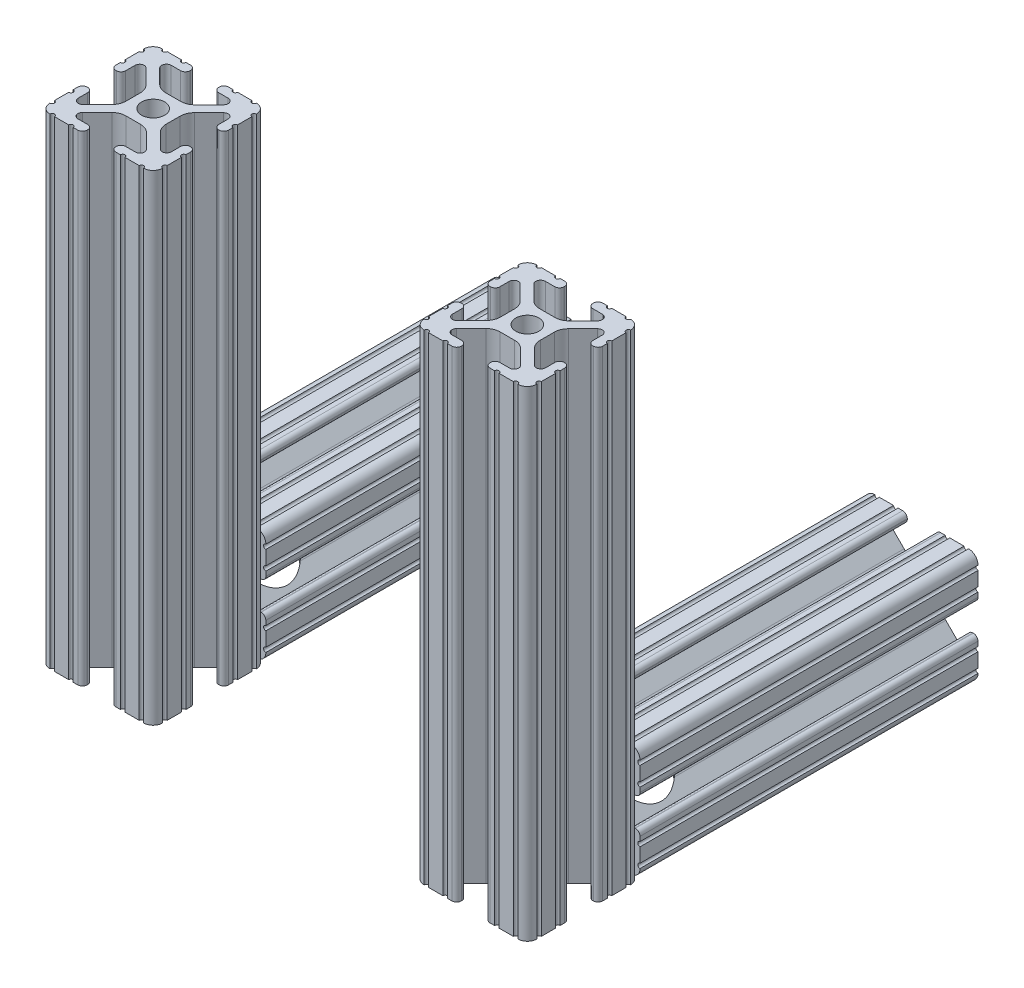
from build123d import *

# Parameters (mm, degrees)
SKETCH110_R                 = 2.6035
F_10_1010_PROFILE_1_DEPTH   = 108.324492
SKETCH110_ON_SEGMENT_2_R    = 2.6035
F_10_1010_PROFILE_1_2_DEPTH = 108.324492
SKETCH113_R                 = 2.6035
F_10_1010_PROFILE_3_DEPTH   = 76.2
SKETCH113_ON_SEGMENT_2_R    = 2.6035
F_10_1010_PROFILE_3_2_DEPTH = 76.2
SKETCH114_R                 = 7.065
CUT_EXTRUDE1_DEPTH          = 10.414
SKETCH115_R                 = 7.065
CUT_EXTRUDE2_DEPTH          = 10.414


with BuildPart() as part:
    # Sketch110 → 10 1010 PROFILE(1) (new body)
    with BuildSketch(Plane(origin=(-42.1775, 54.162246, 0), x_dir=(1, 0, 0), z_dir=(0, -1, 0))):
        with BuildLine():
            Line((-1.709253557, -4.4958), (1.709253557, -4.4958))
            ThreePointArc((1.709253557, -4.4958), (2.922935876, -4.736928798), (3.95226937, -5.423689619))
            Line((3.95226937, -5.423689619), (7.179652728, -8.645192207))
            ThreePointArc((7.179652728, -8.645192207), (7.414733441, -9.822812921), (6.41641086, -10.4902))
            Line((6.41641086, -10.4902), (4.28752, -10.4902))
            ThreePointArc((4.28752, -10.4902), (3.545750844, -10.797450844), (3.2385, -11.53922))
            Line((3.2385, -11.53922), (3.2385, -11.65098))
            ThreePointArc((3.2385, -11.65098), (3.545750844, -12.392749156), (4.28752, -12.7))
            Line((4.28752, -12.7), (5.3171344, -12.7))
            ThreePointArc((5.3171344, -12.7), (5.8251344, -12.192), (6.3331344, -12.7))
            Line((6.3331344, -12.7), (9.5504, -12.7))
            ThreePointArc((9.5504, -12.7), (10.058323491, -12.192000006), (10.566399977, -12.699846982))
            ThreePointArc((10.566399977, -12.699846982), (12.082522516, -12.082522516), (12.699846982, -10.566399977))
            ThreePointArc((12.699846982, -10.566399977), (12.192000006, -10.058323491), (12.7, -9.5504))
            Line((12.7, -9.5504), (12.7, -6.3330836))
            ThreePointArc((12.7, -6.3330836), (12.192, -5.8250836), (12.7, -5.3170836))
            Line((12.7, -5.3170836), (12.7, -4.287470133))
            ThreePointArc((12.7, -4.287470133), (12.392749156, -3.545700977), (11.65098, -3.238450133))
            Line((11.65098, -3.238450133), (11.53922, -3.238450133))
            ThreePointArc((11.53922, -3.238450133), (10.797450844, -3.545700977), (10.4902, -4.287470133))
            Line((10.4902, -4.287470133), (10.4902, -6.402089023))
            ThreePointArc((10.4902, -6.402089023), (9.856394933, -7.351113629), (8.736962546, -7.129240479))
            Line((8.736962546, -7.129240479), (5.440484187, -3.838768792))
            ThreePointArc((5.440484187, -3.838768792), (4.75073678, -2.808015636), (4.5085, -1.591658411))
            Line((4.5085, -1.591658411), (4.5085, 1.591658411))
            ThreePointArc((4.5085, 1.591658411), (4.75073678, 2.808015636), (5.440484187, 3.838768792))
            Line((5.440484187, 3.838768792), (8.736962546, 7.129240479))
            ThreePointArc((8.736962546, 7.129240479), (9.856394933, 7.351113629), (10.4902, 6.402089023))
            Line((10.4902, 6.402089023), (10.4902, 4.287470133))
            ThreePointArc((10.4902, 4.287470133), (10.797450844, 3.545700977), (11.53922, 3.238450133))
            Line((11.53922, 3.238450133), (11.65098, 3.238450133))
            ThreePointArc((11.65098, 3.238450133), (12.392749156, 3.545700977), (12.7, 4.287470133))
            Line((12.7, 4.287470133), (12.7, 5.3171344))
            ThreePointArc((12.7, 5.3171344), (12.192, 5.8251344), (12.7, 6.3331344))
            Line((12.7, 6.3331344), (12.7, 9.5504))
            ThreePointArc((12.7, 9.5504), (12.192000006, 10.058323491), (12.699846982, 10.566399977))
            ThreePointArc((12.699846982, 10.566399977), (12.082522516, 12.082522516), (10.566399977, 12.699846982))
            ThreePointArc((10.566399977, 12.699846982), (10.058323491, 12.192000006), (9.5504, 12.7))
            Line((9.5504, 12.7), (6.3330836, 12.7))
            ThreePointArc((6.3330836, 12.7), (5.8250836, 12.192), (5.3170836, 12.7))
            Line((5.3170836, 12.7), (4.2874692, 12.7))
            ThreePointArc((4.2874692, 12.7), (3.545700044, 12.392749156), (3.2384492, 11.65098))
            Line((3.2384492, 11.65098), (3.2384492, 11.53922))
            ThreePointArc((3.2384492, 11.53922), (3.545700044, 10.797450844), (4.2874692, 10.4902))
            Line((4.2874692, 10.4902), (6.476774195, 10.4902))
            ThreePointArc((6.476774195, 10.4902), (7.43216212, 9.851515102), (7.207191475, 8.724540082))
            Line((7.207191475, 8.724540082), (3.900315394, 5.423689619))
            ThreePointArc((3.900315394, 5.423689619), (2.8709819, 4.736928798), (1.657299581, 4.4958))
            Line((1.657299581, 4.4958), (-1.657299581, 4.4958))
            ThreePointArc((-1.657299581, 4.4958), (-2.8709819, 4.736928798), (-3.900315394, 5.423689619))
            Line((-3.900315394, 5.423689619), (-7.207191475, 8.724540082))
            ThreePointArc((-7.207191475, 8.724540082), (-7.43216212, 9.851515102), (-6.476774195, 10.4902))
            Line((-6.476774195, 10.4902), (-4.2874692, 10.4902))
            ThreePointArc((-4.2874692, 10.4902), (-3.545700044, 10.797450844), (-3.2384492, 11.53922))
            Line((-3.2384492, 11.53922), (-3.2384492, 11.65098))
            ThreePointArc((-3.2384492, 11.65098), (-3.545700044, 12.392749156), (-4.2874692, 12.7))
            Line((-4.2874692, 12.7), (-5.3170836, 12.7))
            ThreePointArc((-5.3170836, 12.7), (-5.8250836, 12.192), (-6.3330836, 12.7))
            Line((-6.3330836, 12.7), (-9.5504, 12.7))
            ThreePointArc((-9.5504, 12.7), (-10.058323491, 12.192000006), (-10.566399977, 12.699846982))
            ThreePointArc((-10.566399977, 12.699846982), (-12.082522516, 12.082522516), (-12.699846982, 10.566399977))
            ThreePointArc((-12.699846982, 10.566399977), (-12.192000006, 10.058323491), (-12.7, 9.5504))
            Line((-12.7, 9.5504), (-12.7, 6.3331344))
            ThreePointArc((-12.7, 6.3331344), (-12.192, 5.8251344), (-12.7, 5.3171344))
            Line((-12.7, 5.3171344), (-12.7, 4.287470133))
            ThreePointArc((-12.7, 4.287470133), (-12.392749156, 3.545700977), (-11.65098, 3.238450133))
            Line((-11.65098, 3.238450133), (-11.53922, 3.238450133))
            ThreePointArc((-11.53922, 3.238450133), (-10.797450844, 3.545700977), (-10.4902, 4.287470133))
            Line((-10.4902, 4.287470133), (-10.4902, 6.402089023))
            ThreePointArc((-10.4902, 6.402089023), (-9.856394933, 7.351113629), (-8.736962546, 7.129240479))
            Line((-8.736962546, 7.129240479), (-5.440484187, 3.838768792))
            ThreePointArc((-5.440484187, 3.838768792), (-4.75073678, 2.808015636), (-4.5085, 1.591658411))
            Line((-4.5085, 1.591658411), (-4.5085, -1.591658411))
            ThreePointArc((-4.5085, -1.591658411), (-4.75073678, -2.808015636), (-5.440484187, -3.838768792))
            Line((-5.440484187, -3.838768792), (-8.736962546, -7.129240479))
            ThreePointArc((-8.736962546, -7.129240479), (-9.856394933, -7.351113629), (-10.4902, -6.402089023))
            Line((-10.4902, -6.402089023), (-10.4902, -4.287470133))
            ThreePointArc((-10.4902, -4.287470133), (-10.797450844, -3.545700977), (-11.53922, -3.238450133))
            Line((-11.53922, -3.238450133), (-11.65098, -3.238450133))
            ThreePointArc((-11.65098, -3.238450133), (-12.392749156, -3.545700977), (-12.7, -4.287470133))
            Line((-12.7, -4.287470133), (-12.7, -5.3170836))
            ThreePointArc((-12.7, -5.3170836), (-12.192, -5.8250836), (-12.7, -6.3330836))
            Line((-12.7, -6.3330836), (-12.7, -9.5504))
            ThreePointArc((-12.7, -9.5504), (-12.192000006, -10.058323491), (-12.699846982, -10.566399977))
            ThreePointArc((-12.699846982, -10.566399977), (-12.082522516, -12.082522516), (-10.566399977, -12.699846982))
            ThreePointArc((-10.566399977, -12.699846982), (-10.058323491, -12.192000006), (-9.5504, -12.7))
            Line((-9.5504, -12.7), (-6.3331344, -12.7))
            ThreePointArc((-6.3331344, -12.7), (-5.8251344, -12.192), (-5.3171344, -12.7))
            Line((-5.3171344, -12.7), (-4.28752, -12.7))
            ThreePointArc((-4.28752, -12.7), (-3.545750844, -12.392749156), (-3.2385, -11.65098))
            Line((-3.2385, -11.65098), (-3.2385, -11.53922))
            ThreePointArc((-3.2385, -11.53922), (-3.545750844, -10.797450844), (-4.28752, -10.4902))
            Line((-4.28752, -10.4902), (-6.41641086, -10.4902))
            ThreePointArc((-6.41641086, -10.4902), (-7.414733441, -9.822812921), (-7.179652728, -8.645192207))
            Line((-7.179652728, -8.645192207), (-3.95226937, -5.423689619))
            ThreePointArc((-3.95226937, -5.423689619), (-2.922935876, -4.736928798), (-1.709253557, -4.4958))
        make_face()
        Circle(SKETCH110_R, mode=Mode.SUBTRACT)
    extrude(amount=F_10_1010_PROFILE_1_DEPTH)


with BuildPart() as body_2:
    # Sketch110 on segment 2 (carried to segment 2) → 10 1010 PROFILE_1 2 (new body)
    with BuildSketch(Plane(origin=(42.1775, 54.162246, 0), x_dir=(1, 0, 0), z_dir=(0, -1, 0))):
        with BuildLine():
            Line((-1.709253557, -4.4958), (1.709253557, -4.4958))
            ThreePointArc((1.709253557, -4.4958), (2.922935876, -4.736928798), (3.95226937, -5.423689619))
            Line((3.95226937, -5.423689619), (7.179652728, -8.645192207))
            ThreePointArc((7.179652728, -8.645192207), (7.414733441, -9.822812921), (6.41641086, -10.4902))
            Line((6.41641086, -10.4902), (4.28752, -10.4902))
            ThreePointArc((4.28752, -10.4902), (3.545750844, -10.797450844), (3.2385, -11.53922))
            Line((3.2385, -11.53922), (3.2385, -11.65098))
            ThreePointArc((3.2385, -11.65098), (3.545750844, -12.392749156), (4.28752, -12.7))
            Line((4.28752, -12.7), (5.3171344, -12.7))
            ThreePointArc((5.3171344, -12.7), (5.8251344, -12.192), (6.3331344, -12.7))
            Line((6.3331344, -12.7), (9.5504, -12.7))
            ThreePointArc((9.5504, -12.7), (10.058323491, -12.192000006), (10.566399977, -12.699846982))
            ThreePointArc((10.566399977, -12.699846982), (12.082522516, -12.082522516), (12.699846982, -10.566399977))
            ThreePointArc((12.699846982, -10.566399977), (12.192000006, -10.058323491), (12.7, -9.5504))
            Line((12.7, -9.5504), (12.7, -6.3330836))
            ThreePointArc((12.7, -6.3330836), (12.192, -5.8250836), (12.7, -5.3170836))
            Line((12.7, -5.3170836), (12.7, -4.287470133))
            ThreePointArc((12.7, -4.287470133), (12.392749156, -3.545700977), (11.65098, -3.238450133))
            Line((11.65098, -3.238450133), (11.53922, -3.238450133))
            ThreePointArc((11.53922, -3.238450133), (10.797450844, -3.545700977), (10.4902, -4.287470133))
            Line((10.4902, -4.287470133), (10.4902, -6.402089023))
            ThreePointArc((10.4902, -6.402089023), (9.856394933, -7.351113629), (8.736962546, -7.129240479))
            Line((8.736962546, -7.129240479), (5.440484187, -3.838768792))
            ThreePointArc((5.440484187, -3.838768792), (4.75073678, -2.808015636), (4.5085, -1.591658411))
            Line((4.5085, -1.591658411), (4.5085, 1.591658411))
            ThreePointArc((4.5085, 1.591658411), (4.75073678, 2.808015636), (5.440484187, 3.838768792))
            Line((5.440484187, 3.838768792), (8.736962546, 7.129240479))
            ThreePointArc((8.736962546, 7.129240479), (9.856394933, 7.351113629), (10.4902, 6.402089023))
            Line((10.4902, 6.402089023), (10.4902, 4.287470133))
            ThreePointArc((10.4902, 4.287470133), (10.797450844, 3.545700977), (11.53922, 3.238450133))
            Line((11.53922, 3.238450133), (11.65098, 3.238450133))
            ThreePointArc((11.65098, 3.238450133), (12.392749156, 3.545700977), (12.7, 4.287470133))
            Line((12.7, 4.287470133), (12.7, 5.3171344))
            ThreePointArc((12.7, 5.3171344), (12.192, 5.8251344), (12.7, 6.3331344))
            Line((12.7, 6.3331344), (12.7, 9.5504))
            ThreePointArc((12.7, 9.5504), (12.192000006, 10.058323491), (12.699846982, 10.566399977))
            ThreePointArc((12.699846982, 10.566399977), (12.082522516, 12.082522516), (10.566399977, 12.699846982))
            ThreePointArc((10.566399977, 12.699846982), (10.058323491, 12.192000006), (9.5504, 12.7))
            Line((9.5504, 12.7), (6.3330836, 12.7))
            ThreePointArc((6.3330836, 12.7), (5.8250836, 12.192), (5.3170836, 12.7))
            Line((5.3170836, 12.7), (4.2874692, 12.7))
            ThreePointArc((4.2874692, 12.7), (3.545700044, 12.392749156), (3.2384492, 11.65098))
            Line((3.2384492, 11.65098), (3.2384492, 11.53922))
            ThreePointArc((3.2384492, 11.53922), (3.545700044, 10.797450844), (4.2874692, 10.4902))
            Line((4.2874692, 10.4902), (6.476774195, 10.4902))
            ThreePointArc((6.476774195, 10.4902), (7.43216212, 9.851515102), (7.207191475, 8.724540082))
            Line((7.207191475, 8.724540082), (3.900315394, 5.423689619))
            ThreePointArc((3.900315394, 5.423689619), (2.8709819, 4.736928798), (1.657299581, 4.4958))
            Line((1.657299581, 4.4958), (-1.657299581, 4.4958))
            ThreePointArc((-1.657299581, 4.4958), (-2.8709819, 4.736928798), (-3.900315394, 5.423689619))
            Line((-3.900315394, 5.423689619), (-7.207191475, 8.724540082))
            ThreePointArc((-7.207191475, 8.724540082), (-7.43216212, 9.851515102), (-6.476774195, 10.4902))
            Line((-6.476774195, 10.4902), (-4.2874692, 10.4902))
            ThreePointArc((-4.2874692, 10.4902), (-3.545700044, 10.797450844), (-3.2384492, 11.53922))
            Line((-3.2384492, 11.53922), (-3.2384492, 11.65098))
            ThreePointArc((-3.2384492, 11.65098), (-3.545700044, 12.392749156), (-4.2874692, 12.7))
            Line((-4.2874692, 12.7), (-5.3170836, 12.7))
            ThreePointArc((-5.3170836, 12.7), (-5.8250836, 12.192), (-6.3330836, 12.7))
            Line((-6.3330836, 12.7), (-9.5504, 12.7))
            ThreePointArc((-9.5504, 12.7), (-10.058323491, 12.192000006), (-10.566399977, 12.699846982))
            ThreePointArc((-10.566399977, 12.699846982), (-12.082522516, 12.082522516), (-12.699846982, 10.566399977))
            ThreePointArc((-12.699846982, 10.566399977), (-12.192000006, 10.058323491), (-12.7, 9.5504))
            Line((-12.7, 9.5504), (-12.7, 6.3331344))
            ThreePointArc((-12.7, 6.3331344), (-12.192, 5.8251344), (-12.7, 5.3171344))
            Line((-12.7, 5.3171344), (-12.7, 4.287470133))
            ThreePointArc((-12.7, 4.287470133), (-12.392749156, 3.545700977), (-11.65098, 3.238450133))
            Line((-11.65098, 3.238450133), (-11.53922, 3.238450133))
            ThreePointArc((-11.53922, 3.238450133), (-10.797450844, 3.545700977), (-10.4902, 4.287470133))
            Line((-10.4902, 4.287470133), (-10.4902, 6.402089023))
            ThreePointArc((-10.4902, 6.402089023), (-9.856394933, 7.351113629), (-8.736962546, 7.129240479))
            Line((-8.736962546, 7.129240479), (-5.440484187, 3.838768792))
            ThreePointArc((-5.440484187, 3.838768792), (-4.75073678, 2.808015636), (-4.5085, 1.591658411))
            Line((-4.5085, 1.591658411), (-4.5085, -1.591658411))
            ThreePointArc((-4.5085, -1.591658411), (-4.75073678, -2.808015636), (-5.440484187, -3.838768792))
            Line((-5.440484187, -3.838768792), (-8.736962546, -7.129240479))
            ThreePointArc((-8.736962546, -7.129240479), (-9.856394933, -7.351113629), (-10.4902, -6.402089023))
            Line((-10.4902, -6.402089023), (-10.4902, -4.287470133))
            ThreePointArc((-10.4902, -4.287470133), (-10.797450844, -3.545700977), (-11.53922, -3.238450133))
            Line((-11.53922, -3.238450133), (-11.65098, -3.238450133))
            ThreePointArc((-11.65098, -3.238450133), (-12.392749156, -3.545700977), (-12.7, -4.287470133))
            Line((-12.7, -4.287470133), (-12.7, -5.3170836))
            ThreePointArc((-12.7, -5.3170836), (-12.192, -5.8250836), (-12.7, -6.3330836))
            Line((-12.7, -6.3330836), (-12.7, -9.5504))
            ThreePointArc((-12.7, -9.5504), (-12.192000006, -10.058323491), (-12.699846982, -10.566399977))
            ThreePointArc((-12.699846982, -10.566399977), (-12.082522516, -12.082522516), (-10.566399977, -12.699846982))
            ThreePointArc((-10.566399977, -12.699846982), (-10.058323491, -12.192000006), (-9.5504, -12.7))
            Line((-9.5504, -12.7), (-6.3331344, -12.7))
            ThreePointArc((-6.3331344, -12.7), (-5.8251344, -12.192), (-5.3171344, -12.7))
            Line((-5.3171344, -12.7), (-4.28752, -12.7))
            ThreePointArc((-4.28752, -12.7), (-3.545750844, -12.392749156), (-3.2385, -11.65098))
            Line((-3.2385, -11.65098), (-3.2385, -11.53922))
            ThreePointArc((-3.2385, -11.53922), (-3.545750844, -10.797450844), (-4.28752, -10.4902))
            Line((-4.28752, -10.4902), (-6.41641086, -10.4902))
            ThreePointArc((-6.41641086, -10.4902), (-7.414733441, -9.822812921), (-7.179652728, -8.645192207))
            Line((-7.179652728, -8.645192207), (-3.95226937, -5.423689619))
            ThreePointArc((-3.95226937, -5.423689619), (-2.922935876, -4.736928798), (-1.709253557, -4.4958))
        make_face()
        Circle(SKETCH110_ON_SEGMENT_2_R, mode=Mode.SUBTRACT)
    extrude(amount=F_10_1010_PROFILE_1_2_DEPTH)


with BuildPart() as body_3:
    # Sketch113 → 10 1010 PROFILE(3) (new body)
    with BuildSketch(Plane(origin=(42.1775, -41.462246, -12.7), x_dir=(1, 0, 0), z_dir=(0, 0, -1))):
        with BuildLine():
            Line((-1.709253557, -4.4958), (1.709253557, -4.4958))
            ThreePointArc((1.709253557, -4.4958), (2.922935876, -4.736928798), (3.95226937, -5.423689619))
            Line((3.95226937, -5.423689619), (7.179652728, -8.645192207))
            ThreePointArc((7.179652728, -8.645192207), (7.414733441, -9.822812921), (6.41641086, -10.4902))
            Line((6.41641086, -10.4902), (4.28752, -10.4902))
            ThreePointArc((4.28752, -10.4902), (3.545750844, -10.797450844), (3.2385, -11.53922))
            Line((3.2385, -11.53922), (3.2385, -11.65098))
            ThreePointArc((3.2385, -11.65098), (3.545750844, -12.392749156), (4.28752, -12.7))
            Line((4.28752, -12.7), (5.3171344, -12.7))
            ThreePointArc((5.3171344, -12.7), (5.8251344, -12.192), (6.3331344, -12.7))
            Line((6.3331344, -12.7), (9.5504, -12.7))
            ThreePointArc((9.5504, -12.7), (10.058323491, -12.192000006), (10.566399977, -12.699846982))
            ThreePointArc((10.566399977, -12.699846982), (12.082522516, -12.082522516), (12.699846982, -10.566399977))
            ThreePointArc((12.699846982, -10.566399977), (12.192000006, -10.058323491), (12.7, -9.5504))
            Line((12.7, -9.5504), (12.7, -6.3330836))
            ThreePointArc((12.7, -6.3330836), (12.192, -5.8250836), (12.7, -5.3170836))
            Line((12.7, -5.3170836), (12.7, -4.287470133))
            ThreePointArc((12.7, -4.287470133), (12.392749156, -3.545700977), (11.65098, -3.238450133))
            Line((11.65098, -3.238450133), (11.53922, -3.238450133))
            ThreePointArc((11.53922, -3.238450133), (10.797450844, -3.545700977), (10.4902, -4.287470133))
            Line((10.4902, -4.287470133), (10.4902, -6.402089023))
            ThreePointArc((10.4902, -6.402089023), (9.856394933, -7.351113629), (8.736962546, -7.129240479))
            Line((8.736962546, -7.129240479), (5.440484187, -3.838768792))
            ThreePointArc((5.440484187, -3.838768792), (4.75073678, -2.808015636), (4.5085, -1.591658411))
            Line((4.5085, -1.591658411), (4.5085, 1.591658411))
            ThreePointArc((4.5085, 1.591658411), (4.75073678, 2.808015636), (5.440484187, 3.838768792))
            Line((5.440484187, 3.838768792), (8.736962546, 7.129240479))
            ThreePointArc((8.736962546, 7.129240479), (9.856394933, 7.351113629), (10.4902, 6.402089023))
            Line((10.4902, 6.402089023), (10.4902, 4.287470133))
            ThreePointArc((10.4902, 4.287470133), (10.797450844, 3.545700977), (11.53922, 3.238450133))
            Line((11.53922, 3.238450133), (11.65098, 3.238450133))
            ThreePointArc((11.65098, 3.238450133), (12.392749156, 3.545700977), (12.7, 4.287470133))
            Line((12.7, 4.287470133), (12.7, 5.3171344))
            ThreePointArc((12.7, 5.3171344), (12.192, 5.8251344), (12.7, 6.3331344))
            Line((12.7, 6.3331344), (12.7, 9.5504))
            ThreePointArc((12.7, 9.5504), (12.192000006, 10.058323491), (12.699846982, 10.566399977))
            ThreePointArc((12.699846982, 10.566399977), (12.082522516, 12.082522516), (10.566399977, 12.699846982))
            ThreePointArc((10.566399977, 12.699846982), (10.058323491, 12.192000006), (9.5504, 12.7))
            Line((9.5504, 12.7), (6.3330836, 12.7))
            ThreePointArc((6.3330836, 12.7), (5.8250836, 12.192), (5.3170836, 12.7))
            Line((5.3170836, 12.7), (4.2874692, 12.7))
            ThreePointArc((4.2874692, 12.7), (3.545700044, 12.392749156), (3.2384492, 11.65098))
            Line((3.2384492, 11.65098), (3.2384492, 11.53922))
            ThreePointArc((3.2384492, 11.53922), (3.545700044, 10.797450844), (4.2874692, 10.4902))
            Line((4.2874692, 10.4902), (6.476774195, 10.4902))
            ThreePointArc((6.476774195, 10.4902), (7.43216212, 9.851515102), (7.207191475, 8.724540082))
            Line((7.207191475, 8.724540082), (3.900315394, 5.423689619))
            ThreePointArc((3.900315394, 5.423689619), (2.8709819, 4.736928798), (1.657299581, 4.4958))
            Line((1.657299581, 4.4958), (-1.657299581, 4.4958))
            ThreePointArc((-1.657299581, 4.4958), (-2.8709819, 4.736928798), (-3.900315394, 5.423689619))
            Line((-3.900315394, 5.423689619), (-7.207191475, 8.724540082))
            ThreePointArc((-7.207191475, 8.724540082), (-7.43216212, 9.851515102), (-6.476774195, 10.4902))
            Line((-6.476774195, 10.4902), (-4.2874692, 10.4902))
            ThreePointArc((-4.2874692, 10.4902), (-3.545700044, 10.797450844), (-3.2384492, 11.53922))
            Line((-3.2384492, 11.53922), (-3.2384492, 11.65098))
            ThreePointArc((-3.2384492, 11.65098), (-3.545700044, 12.392749156), (-4.2874692, 12.7))
            Line((-4.2874692, 12.7), (-5.3170836, 12.7))
            ThreePointArc((-5.3170836, 12.7), (-5.8250836, 12.192), (-6.3330836, 12.7))
            Line((-6.3330836, 12.7), (-9.5504, 12.7))
            ThreePointArc((-9.5504, 12.7), (-10.058323491, 12.192000006), (-10.566399977, 12.699846982))
            ThreePointArc((-10.566399977, 12.699846982), (-12.082522516, 12.082522516), (-12.699846982, 10.566399977))
            ThreePointArc((-12.699846982, 10.566399977), (-12.192000006, 10.058323491), (-12.7, 9.5504))
            Line((-12.7, 9.5504), (-12.7, 6.3331344))
            ThreePointArc((-12.7, 6.3331344), (-12.192, 5.8251344), (-12.7, 5.3171344))
            Line((-12.7, 5.3171344), (-12.7, 4.287470133))
            ThreePointArc((-12.7, 4.287470133), (-12.392749156, 3.545700977), (-11.65098, 3.238450133))
            Line((-11.65098, 3.238450133), (-11.53922, 3.238450133))
            ThreePointArc((-11.53922, 3.238450133), (-10.797450844, 3.545700977), (-10.4902, 4.287470133))
            Line((-10.4902, 4.287470133), (-10.4902, 6.402089023))
            ThreePointArc((-10.4902, 6.402089023), (-9.856394933, 7.351113629), (-8.736962546, 7.129240479))
            Line((-8.736962546, 7.129240479), (-5.440484187, 3.838768792))
            ThreePointArc((-5.440484187, 3.838768792), (-4.75073678, 2.808015636), (-4.5085, 1.591658411))
            Line((-4.5085, 1.591658411), (-4.5085, -1.591658411))
            ThreePointArc((-4.5085, -1.591658411), (-4.75073678, -2.808015636), (-5.440484187, -3.838768792))
            Line((-5.440484187, -3.838768792), (-8.736962546, -7.129240479))
            ThreePointArc((-8.736962546, -7.129240479), (-9.856394933, -7.351113629), (-10.4902, -6.402089023))
            Line((-10.4902, -6.402089023), (-10.4902, -4.287470133))
            ThreePointArc((-10.4902, -4.287470133), (-10.797450844, -3.545700977), (-11.53922, -3.238450133))
            Line((-11.53922, -3.238450133), (-11.65098, -3.238450133))
            ThreePointArc((-11.65098, -3.238450133), (-12.392749156, -3.545700977), (-12.7, -4.287470133))
            Line((-12.7, -4.287470133), (-12.7, -5.3170836))
            ThreePointArc((-12.7, -5.3170836), (-12.192, -5.8250836), (-12.7, -6.3330836))
            Line((-12.7, -6.3330836), (-12.7, -9.5504))
            ThreePointArc((-12.7, -9.5504), (-12.192000006, -10.058323491), (-12.699846982, -10.566399977))
            ThreePointArc((-12.699846982, -10.566399977), (-12.082522516, -12.082522516), (-10.566399977, -12.699846982))
            ThreePointArc((-10.566399977, -12.699846982), (-10.058323491, -12.192000006), (-9.5504, -12.7))
            Line((-9.5504, -12.7), (-6.3331344, -12.7))
            ThreePointArc((-6.3331344, -12.7), (-5.8251344, -12.192), (-5.3171344, -12.7))
            Line((-5.3171344, -12.7), (-4.28752, -12.7))
            ThreePointArc((-4.28752, -12.7), (-3.545750844, -12.392749156), (-3.2385, -11.65098))
            Line((-3.2385, -11.65098), (-3.2385, -11.53922))
            ThreePointArc((-3.2385, -11.53922), (-3.545750844, -10.797450844), (-4.28752, -10.4902))
            Line((-4.28752, -10.4902), (-6.41641086, -10.4902))
            ThreePointArc((-6.41641086, -10.4902), (-7.414733441, -9.822812921), (-7.179652728, -8.645192207))
            Line((-7.179652728, -8.645192207), (-3.95226937, -5.423689619))
            ThreePointArc((-3.95226937, -5.423689619), (-2.922935876, -4.736928798), (-1.709253557, -4.4958))
        make_face()
        Circle(SKETCH113_R, mode=Mode.SUBTRACT)
    extrude(amount=F_10_1010_PROFILE_3_DEPTH)

    # Sketch114 → Cut-Extrude1 (cut)
    with BuildSketch(Plane.XZ.offset(54.162246)):
        with Locations(Location((42.1775254, -23.2, 0), (0, 0, 39.640915006))):
            Circle(SKETCH114_R)
    extrude(amount=-CUT_EXTRUDE1_DEPTH, mode=Mode.SUBTRACT)


with BuildPart() as body_4:
    # Sketch113 on segment 2 (carried to segment 2) → 10 1010 PROFILE_3 2 (new body)
    with BuildSketch(Plane(origin=(-42.1775, -41.462246, -12.7), x_dir=(1, 0, 0), z_dir=(0, 0, -1))):
        with BuildLine():
            Line((-1.709253557, -4.4958), (1.709253557, -4.4958))
            ThreePointArc((1.709253557, -4.4958), (2.922935876, -4.736928798), (3.95226937, -5.423689619))
            Line((3.95226937, -5.423689619), (7.179652728, -8.645192207))
            ThreePointArc((7.179652728, -8.645192207), (7.414733441, -9.822812921), (6.41641086, -10.4902))
            Line((6.41641086, -10.4902), (4.28752, -10.4902))
            ThreePointArc((4.28752, -10.4902), (3.545750844, -10.797450844), (3.2385, -11.53922))
            Line((3.2385, -11.53922), (3.2385, -11.65098))
            ThreePointArc((3.2385, -11.65098), (3.545750844, -12.392749156), (4.28752, -12.7))
            Line((4.28752, -12.7), (5.3171344, -12.7))
            ThreePointArc((5.3171344, -12.7), (5.8251344, -12.192), (6.3331344, -12.7))
            Line((6.3331344, -12.7), (9.5504, -12.7))
            ThreePointArc((9.5504, -12.7), (10.058323491, -12.192000006), (10.566399977, -12.699846982))
            ThreePointArc((10.566399977, -12.699846982), (12.082522516, -12.082522516), (12.699846982, -10.566399977))
            ThreePointArc((12.699846982, -10.566399977), (12.192000006, -10.058323491), (12.7, -9.5504))
            Line((12.7, -9.5504), (12.7, -6.3330836))
            ThreePointArc((12.7, -6.3330836), (12.192, -5.8250836), (12.7, -5.3170836))
            Line((12.7, -5.3170836), (12.7, -4.287470133))
            ThreePointArc((12.7, -4.287470133), (12.392749156, -3.545700977), (11.65098, -3.238450133))
            Line((11.65098, -3.238450133), (11.53922, -3.238450133))
            ThreePointArc((11.53922, -3.238450133), (10.797450844, -3.545700977), (10.4902, -4.287470133))
            Line((10.4902, -4.287470133), (10.4902, -6.402089023))
            ThreePointArc((10.4902, -6.402089023), (9.856394933, -7.351113629), (8.736962546, -7.129240479))
            Line((8.736962546, -7.129240479), (5.440484187, -3.838768792))
            ThreePointArc((5.440484187, -3.838768792), (4.75073678, -2.808015636), (4.5085, -1.591658411))
            Line((4.5085, -1.591658411), (4.5085, 1.591658411))
            ThreePointArc((4.5085, 1.591658411), (4.75073678, 2.808015636), (5.440484187, 3.838768792))
            Line((5.440484187, 3.838768792), (8.736962546, 7.129240479))
            ThreePointArc((8.736962546, 7.129240479), (9.856394933, 7.351113629), (10.4902, 6.402089023))
            Line((10.4902, 6.402089023), (10.4902, 4.287470133))
            ThreePointArc((10.4902, 4.287470133), (10.797450844, 3.545700977), (11.53922, 3.238450133))
            Line((11.53922, 3.238450133), (11.65098, 3.238450133))
            ThreePointArc((11.65098, 3.238450133), (12.392749156, 3.545700977), (12.7, 4.287470133))
            Line((12.7, 4.287470133), (12.7, 5.3171344))
            ThreePointArc((12.7, 5.3171344), (12.192, 5.8251344), (12.7, 6.3331344))
            Line((12.7, 6.3331344), (12.7, 9.5504))
            ThreePointArc((12.7, 9.5504), (12.192000006, 10.058323491), (12.699846982, 10.566399977))
            ThreePointArc((12.699846982, 10.566399977), (12.082522516, 12.082522516), (10.566399977, 12.699846982))
            ThreePointArc((10.566399977, 12.699846982), (10.058323491, 12.192000006), (9.5504, 12.7))
            Line((9.5504, 12.7), (6.3330836, 12.7))
            ThreePointArc((6.3330836, 12.7), (5.8250836, 12.192), (5.3170836, 12.7))
            Line((5.3170836, 12.7), (4.2874692, 12.7))
            ThreePointArc((4.2874692, 12.7), (3.545700044, 12.392749156), (3.2384492, 11.65098))
            Line((3.2384492, 11.65098), (3.2384492, 11.53922))
            ThreePointArc((3.2384492, 11.53922), (3.545700044, 10.797450844), (4.2874692, 10.4902))
            Line((4.2874692, 10.4902), (6.476774195, 10.4902))
            ThreePointArc((6.476774195, 10.4902), (7.43216212, 9.851515102), (7.207191475, 8.724540082))
            Line((7.207191475, 8.724540082), (3.900315394, 5.423689619))
            ThreePointArc((3.900315394, 5.423689619), (2.8709819, 4.736928798), (1.657299581, 4.4958))
            Line((1.657299581, 4.4958), (-1.657299581, 4.4958))
            ThreePointArc((-1.657299581, 4.4958), (-2.8709819, 4.736928798), (-3.900315394, 5.423689619))
            Line((-3.900315394, 5.423689619), (-7.207191475, 8.724540082))
            ThreePointArc((-7.207191475, 8.724540082), (-7.43216212, 9.851515102), (-6.476774195, 10.4902))
            Line((-6.476774195, 10.4902), (-4.2874692, 10.4902))
            ThreePointArc((-4.2874692, 10.4902), (-3.545700044, 10.797450844), (-3.2384492, 11.53922))
            Line((-3.2384492, 11.53922), (-3.2384492, 11.65098))
            ThreePointArc((-3.2384492, 11.65098), (-3.545700044, 12.392749156), (-4.2874692, 12.7))
            Line((-4.2874692, 12.7), (-5.3170836, 12.7))
            ThreePointArc((-5.3170836, 12.7), (-5.8250836, 12.192), (-6.3330836, 12.7))
            Line((-6.3330836, 12.7), (-9.5504, 12.7))
            ThreePointArc((-9.5504, 12.7), (-10.058323491, 12.192000006), (-10.566399977, 12.699846982))
            ThreePointArc((-10.566399977, 12.699846982), (-12.082522516, 12.082522516), (-12.699846982, 10.566399977))
            ThreePointArc((-12.699846982, 10.566399977), (-12.192000006, 10.058323491), (-12.7, 9.5504))
            Line((-12.7, 9.5504), (-12.7, 6.3331344))
            ThreePointArc((-12.7, 6.3331344), (-12.192, 5.8251344), (-12.7, 5.3171344))
            Line((-12.7, 5.3171344), (-12.7, 4.287470133))
            ThreePointArc((-12.7, 4.287470133), (-12.392749156, 3.545700977), (-11.65098, 3.238450133))
            Line((-11.65098, 3.238450133), (-11.53922, 3.238450133))
            ThreePointArc((-11.53922, 3.238450133), (-10.797450844, 3.545700977), (-10.4902, 4.287470133))
            Line((-10.4902, 4.287470133), (-10.4902, 6.402089023))
            ThreePointArc((-10.4902, 6.402089023), (-9.856394933, 7.351113629), (-8.736962546, 7.129240479))
            Line((-8.736962546, 7.129240479), (-5.440484187, 3.838768792))
            ThreePointArc((-5.440484187, 3.838768792), (-4.75073678, 2.808015636), (-4.5085, 1.591658411))
            Line((-4.5085, 1.591658411), (-4.5085, -1.591658411))
            ThreePointArc((-4.5085, -1.591658411), (-4.75073678, -2.808015636), (-5.440484187, -3.838768792))
            Line((-5.440484187, -3.838768792), (-8.736962546, -7.129240479))
            ThreePointArc((-8.736962546, -7.129240479), (-9.856394933, -7.351113629), (-10.4902, -6.402089023))
            Line((-10.4902, -6.402089023), (-10.4902, -4.287470133))
            ThreePointArc((-10.4902, -4.287470133), (-10.797450844, -3.545700977), (-11.53922, -3.238450133))
            Line((-11.53922, -3.238450133), (-11.65098, -3.238450133))
            ThreePointArc((-11.65098, -3.238450133), (-12.392749156, -3.545700977), (-12.7, -4.287470133))
            Line((-12.7, -4.287470133), (-12.7, -5.3170836))
            ThreePointArc((-12.7, -5.3170836), (-12.192, -5.8250836), (-12.7, -6.3330836))
            Line((-12.7, -6.3330836), (-12.7, -9.5504))
            ThreePointArc((-12.7, -9.5504), (-12.192000006, -10.058323491), (-12.699846982, -10.566399977))
            ThreePointArc((-12.699846982, -10.566399977), (-12.082522516, -12.082522516), (-10.566399977, -12.699846982))
            ThreePointArc((-10.566399977, -12.699846982), (-10.058323491, -12.192000006), (-9.5504, -12.7))
            Line((-9.5504, -12.7), (-6.3331344, -12.7))
            ThreePointArc((-6.3331344, -12.7), (-5.8251344, -12.192), (-5.3171344, -12.7))
            Line((-5.3171344, -12.7), (-4.28752, -12.7))
            ThreePointArc((-4.28752, -12.7), (-3.545750844, -12.392749156), (-3.2385, -11.65098))
            Line((-3.2385, -11.65098), (-3.2385, -11.53922))
            ThreePointArc((-3.2385, -11.53922), (-3.545750844, -10.797450844), (-4.28752, -10.4902))
            Line((-4.28752, -10.4902), (-6.41641086, -10.4902))
            ThreePointArc((-6.41641086, -10.4902), (-7.414733441, -9.822812921), (-7.179652728, -8.645192207))
            Line((-7.179652728, -8.645192207), (-3.95226937, -5.423689619))
            ThreePointArc((-3.95226937, -5.423689619), (-2.922935876, -4.736928798), (-1.709253557, -4.4958))
        make_face()
        Circle(SKETCH113_ON_SEGMENT_2_R, mode=Mode.SUBTRACT)
    extrude(amount=F_10_1010_PROFILE_3_2_DEPTH)

    # Sketch115 → Cut-Extrude2 (cut)
    with BuildSketch(Plane.XZ.offset(54.162246)):
        with Locations(Location((-42.1774746, -23.2, 0), (0, 0, 39.640915006))):
            Circle(SKETCH115_R)
    extrude(amount=-CUT_EXTRUDE2_DEPTH, mode=Mode.SUBTRACT)


solid = Compound([part.part, body_2.part, body_3.part, body_4.part])
